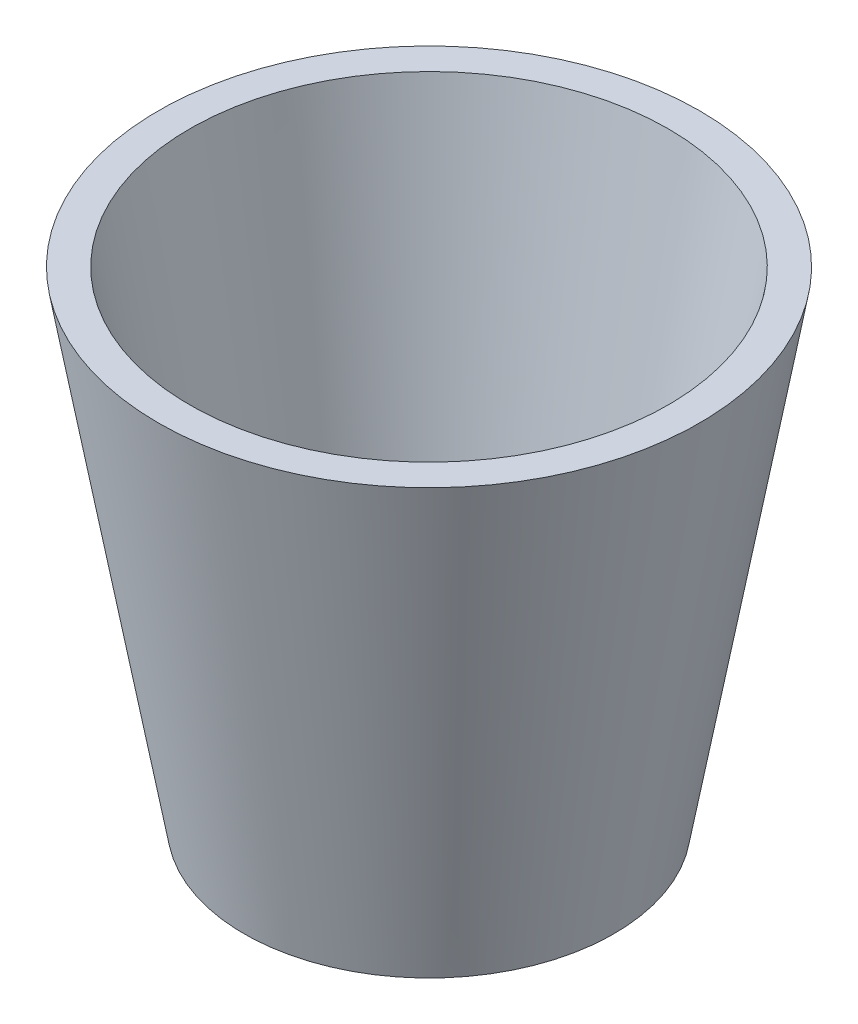
from build123d import *


with BuildPart() as part:
    # Sketch1 → Revolve1 (revolve)
    with BuildSketch(Plane.XY, mode=Mode.PRIVATE) as revolve1_sk:
        Polygon((0, 0), (12, 0), (17.548713294, 31.468316825), (15.51786007, 31.468316825), (10.321800738, 2), (0, 2), align=None)
    revolve(revolve1_sk.sketch.rotate(Axis((0, 0, 0), (0, 1, 0)), 90), axis=Axis((0, 0, 0), (0, 1, 0)))


solid = part.part
